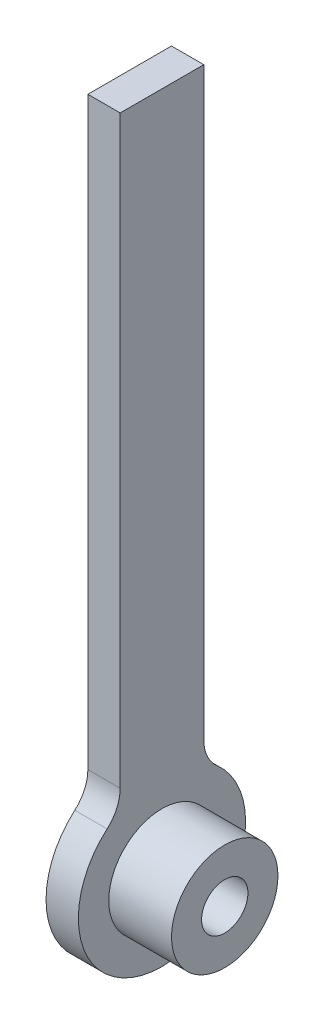
from build123d import *

# Parameters (mm, degrees)
SKETCH2_W           = 44
SKETCH2_H           = 200
BOSS_EXTRUDE2_DEPTH = 8.5
SKETCH4_R           = 11.04
CUT_EXTRUDE1_DEPTH  = 7.5
SKETCH5_OUTSIDE_W   = 86.992
SKETCH5_OUTSIDE_H   = 242.992
SKETCH5_OUTSIDE_R   = 8
CUT_EXTRUDE2_DEPTH  = 10
SKETCH6_R           = 14
BOSS_EXTRUDE3_DEPTH = 16.51
SKETCH8_R           = 6.096
CUT_EXTRUDE4_DEPTH  = 16.51


with BuildPart() as part:
    # Sketch2 → Boss-Extrude2 (new body)
    with BuildSketch(Plane(origin=(0, 0, 0), x_dir=(0, 0, -1), z_dir=(1, 0, 0))):
        with Locations((22, 100)):
            Rectangle(SKETCH2_W, SKETCH2_H)
    extrude(amount=BOSS_EXTRUDE2_DEPTH)

    # Sketch4 → Cut-Extrude1 (cut)
    with BuildSketch(Plane(origin=(0, 0, 0), x_dir=(0, 0, -1), z_dir=(1, 0, 0))):
        with Locations(Location((22, 22, 0), (0, 0, 180))):
            Circle(SKETCH4_R)
    extrude(amount=CUT_EXTRUDE1_DEPTH, mode=Mode.SUBTRACT)

    # Sketch5 outside → Cut-Extrude2 (cut)
    # profile 1 of 2: a face of its own
    with BuildSketch(Plane(origin=(8.5, 0, 0), x_dir=(0, 0, -1), z_dir=(1, 0, 0))):
        with Locations((22, 100)):
            Rectangle(SKETCH5_OUTSIDE_W, SKETCH5_OUTSIDE_H)
        with BuildLine():
            Line((11, 200), (11, 46.145392935))
            ThreePointArc((11, 46.145392935), (10.100137362, 41.999611947), (7.5625, 38.599957643))
            ThreePointArc((7.5625, 38.599957643), (22, 0), (36.4375, 38.599957643))
            ThreePointArc((36.4375, 38.599957643), (33.899862638, 41.999611947), (33, 46.145392935))
            Line((33, 46.145392935), (33, 200))
            Line((33, 200), (11, 200))
        make_face(mode=Mode.SUBTRACT)
    # profile 2 of 2: a face of its own
    with BuildSketch(Plane(origin=(8.5, 0, 0), x_dir=(0, 0, -1), z_dir=(1, 0, 0))):
        with Locations((22, 22)):
            Circle(SKETCH5_OUTSIDE_R)
    extrude(amount=-CUT_EXTRUDE2_DEPTH, mode=Mode.SUBTRACT)

    # Sketch6 → Boss-Extrude3 (add)
    with BuildSketch(Plane(origin=(8.5, 0, 0), x_dir=(0, 0, -1), z_dir=(1, 0, 0))):
        with Locations(Location((22, 22, 0), (0, 0, 180))):
            Circle(SKETCH6_R)
    extrude(amount=BOSS_EXTRUDE3_DEPTH)

    # Sketch8 → Cut-Extrude4 (cut)
    with BuildSketch(Plane(origin=(25.01, 0, 0), x_dir=(0, 0, -1), z_dir=(1, 0, 0))):
        with Locations((22, 22)):
            Circle(SKETCH8_R)
    extrude(amount=-CUT_EXTRUDE4_DEPTH, mode=Mode.SUBTRACT)


solid = part.part
